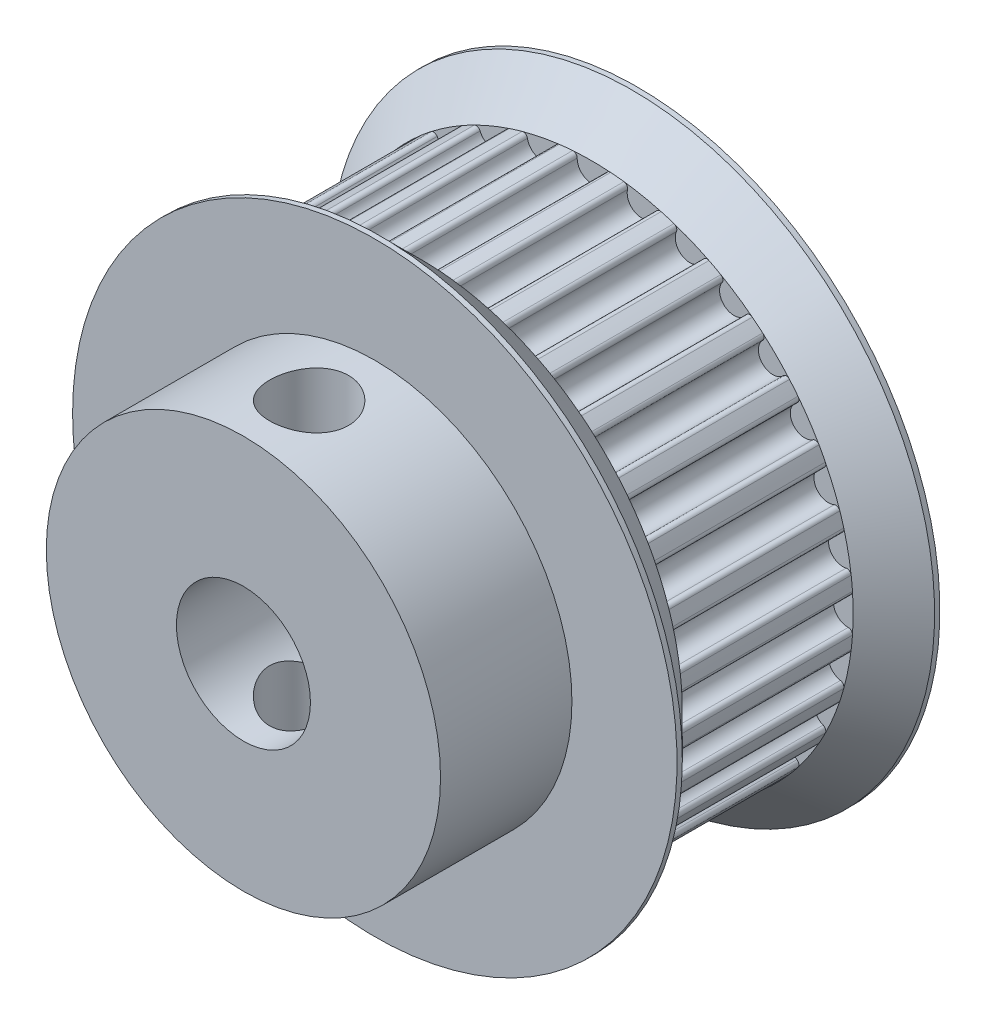
from build123d import *

# Parameters (mm, degrees)
SKETCH2_R               = 0.55
CUT_EXTRUDE1_DEPTH      = 6.5
FILLET1_R               = 0.16
SKETCH3_R               = 7.5
SKETCH3_R_2             = 2.55
BOSS_EXTRUDE1_DEPTH     = 5
CUT_EXTRUDE2_DEPTH      = 23.12464689
CUT_EXTRUDE2_DEPTH_BACK = 23.12464689
SKETCH4_R               = 1.5


with BuildPart() as part:
    # Sketch1 → Revolve1 (revolve)
    with BuildSketch(Plane(origin=(0, 0, 0), x_dir=(0, 0, -1), z_dir=(1, 0, 0)), mode=Mode.PRIVATE) as revolve1_sk:
        Polygon((-1.75, 9.95), (-8.25, 9.95), (-9.8, 11.5), (-10, 11.5), (-10, 2.55), (0, 2.55), (0, 11.5), (-0.2, 11.5), align=None)
    revolve(revolve1_sk.sketch.rotate(Axis((0, 0, 0), (0, 0, 1)), 90), axis=Axis((0, 0, 0), (0, 0, 1)))

    # Sketch2 → Cut-Extrude1 (cut)
    with BuildSketch(Plane.XY.offset(1.75)):
        with Locations((0, 9.75)):
            Circle(SKETCH2_R)
        with Locations((1.90213064, 9.562656484)):
            Circle(SKETCH2_R)
        with Locations((3.731163466, 9.007825442)):
            Circle(SKETCH2_R)
        with Locations((5.416809772, 8.10682872)):
            Circle(SKETCH2_R)
        with Locations((6.894291117, 6.894291117)):
            Circle(SKETCH2_R)
        with Locations((8.10682872, 5.416809772)):
            Circle(SKETCH2_R)
        with Locations((9.007825442, 3.731163466)):
            Circle(SKETCH2_R)
        with Locations((9.562656484, 1.90213064)):
            Circle(SKETCH2_R)
        with Locations((9.75, 0)):
            Circle(SKETCH2_R)
        with Locations((9.562656484, -1.90213064)):
            Circle(SKETCH2_R)
        with Locations((9.007825442, -3.731163466)):
            Circle(SKETCH2_R)
        with Locations((8.10682872, -5.416809772)):
            Circle(SKETCH2_R)
        with Locations((6.894291117, -6.894291117)):
            Circle(SKETCH2_R)
        with Locations((5.416809772, -8.10682872)):
            Circle(SKETCH2_R)
        with Locations((3.731163466, -9.007825442)):
            Circle(SKETCH2_R)
        with Locations((1.90213064, -9.562656484)):
            Circle(SKETCH2_R)
        with Locations((0, -9.75)):
            Circle(SKETCH2_R)
        with Locations((-1.90213064, -9.562656484)):
            Circle(SKETCH2_R)
        with Locations((-3.731163466, -9.007825442)):
            Circle(SKETCH2_R)
        with Locations((-5.416809772, -8.10682872)):
            Circle(SKETCH2_R)
        with Locations((-6.894291117, -6.894291117)):
            Circle(SKETCH2_R)
        with Locations((-8.10682872, -5.416809772)):
            Circle(SKETCH2_R)
        with Locations((-9.007825442, -3.731163466)):
            Circle(SKETCH2_R)
        with Locations((-9.562656484, -1.90213064)):
            Circle(SKETCH2_R)
        with Locations((-9.75, 0)):
            Circle(SKETCH2_R)
        with Locations((-9.562656484, 1.90213064)):
            Circle(SKETCH2_R)
        with Locations((-9.007825442, 3.731163466)):
            Circle(SKETCH2_R)
        with Locations((-8.10682872, 5.416809772)):
            Circle(SKETCH2_R)
        with Locations((-6.894291117, 6.894291117)):
            Circle(SKETCH2_R)
        with Locations((-5.416809772, 8.10682872)):
            Circle(SKETCH2_R)
        with Locations((-3.731163466, 9.007825442)):
            Circle(SKETCH2_R)
        with Locations((-1.90213064, 9.562656484)):
            Circle(SKETCH2_R)
    extrude(amount=CUT_EXTRUDE1_DEPTH, mode=Mode.SUBTRACT)

    # Fillet1
    fillet1_edges = [part.edges().sort_by_distance(p)[0] for p in [
        (-8.982163863, 4.280564488, 5),
        (-9.378165154, 3.324532801, 5),
        (-9.644670808, 2.445981401, 5),
        (-9.846550515, 1.431063575, 5),
        (-9.936538462, 0.517400621, 5),
        (-9.936538462, -0.517400621, 5),
        (-9.846550515, -1.431063575, 5),
        (-9.644670808, -2.445981401, 5),
        (-9.378165154, -3.324532801, 5),
        (-8.982163863, -4.280564488, 5),
        (-8.549382166, -5.090242095, 5),
        (-7.974477399, -5.950647882, 5),
        (-7.392051215, -6.66033624, 5),
        (-6.66033624, -7.392051215, 5),
        (-5.950647882, -7.974477399, 5),
        (-5.090242095, -8.549382166, 5),
        (-4.280564488, -8.982163863, 5),
        (-3.324532801, -9.378165154, 5),
        (-2.445981401, -9.644670808, 5),
        (-1.431063575, -9.846550515, 5),
        (-0.517400621, -9.936538462, 5),
        (0.517400621, -9.936538462, 5),
        (1.431063575, -9.846550515, 5),
        (2.445981401, -9.644670808, 5),
        (3.324532801, -9.378165154, 5),
        (4.280564488, -8.982163863, 5),
        (5.090242095, -8.549382166, 5),
        (5.950647882, -7.974477399, 5),
        (6.66033624, -7.392051215, 5),
        (7.392051215, -6.66033624, 5),
        (7.974477399, -5.950647882, 5),
        (8.549382166, -5.090242095, 5),
        (8.982163863, -4.280564488, 5),
        (9.378165154, -3.324532801, 5),
        (9.644670808, -2.445981401, 5),
        (9.846550515, -1.431063575, 5),
        (9.936538462, -0.517400621, 5),
        (9.936538462, 0.517400621, 5),
        (9.846550515, 1.431063575, 5),
        (9.644670808, 2.445981401, 5),
        (9.378165154, 3.324532801, 5),
        (8.982163863, 4.280564488, 5),
        (8.549382166, 5.090242095, 5),
        (7.974477399, 5.950647882, 5),
        (7.392051215, 6.66033624, 5),
        (6.66033624, 7.392051215, 5),
        (5.950647882, 7.974477399, 5),
        (5.090242095, 8.549382166, 5),
        (4.280564488, 8.982163863, 5),
        (3.324532801, 9.378165154, 5),
        (2.445981401, 9.644670808, 5),
        (1.431063575, 9.846550515, 5),
        (0.517400621, 9.936538462, 5),
        (-0.517400621, 9.936538462, 5),
        (-1.431063575, 9.846550515, 5),
        (-2.445981401, 9.644670808, 5),
        (-3.324532801, 9.378165154, 5),
        (-4.280564488, 8.982163863, 5),
        (-5.090242095, 8.549382166, 5),
        (-5.950647882, 7.974477399, 5),
        (-6.66033624, 7.392051215, 5),
        (-7.392051215, 6.66033624, 5),
        (-7.974477399, 5.950647882, 5),
        (-8.549382166, 5.090242095, 5),
    ]]
    fillet(fillet1_edges, radius=FILLET1_R)

    # Sketch3 → Boss-Extrude1 (add)
    with BuildSketch(Plane.XY.offset(10)):
        Circle(SKETCH3_R)
        with Locations(Location((0, 0, 0), (0, 0, 180))):
            Circle(SKETCH3_R_2, mode=Mode.SUBTRACT)
    extrude(amount=BOSS_EXTRUDE1_DEPTH)

    # Sketch4 → Cut-Extrude2 (cut, two sides: drawn at the far end of the back side and taken through both)
    with BuildSketch(Plane(origin=(0, 0, 0), x_dir=(1, 0, 0), z_dir=(0, 1, 0)).offset(-CUT_EXTRUDE2_DEPTH_BACK)):
        with Locations(Location((0, -12.5, 0), (0, 0, 270))):
            Circle(SKETCH4_R)
    extrude(amount=CUT_EXTRUDE2_DEPTH + CUT_EXTRUDE2_DEPTH_BACK, mode=Mode.SUBTRACT)


solid = part.part
